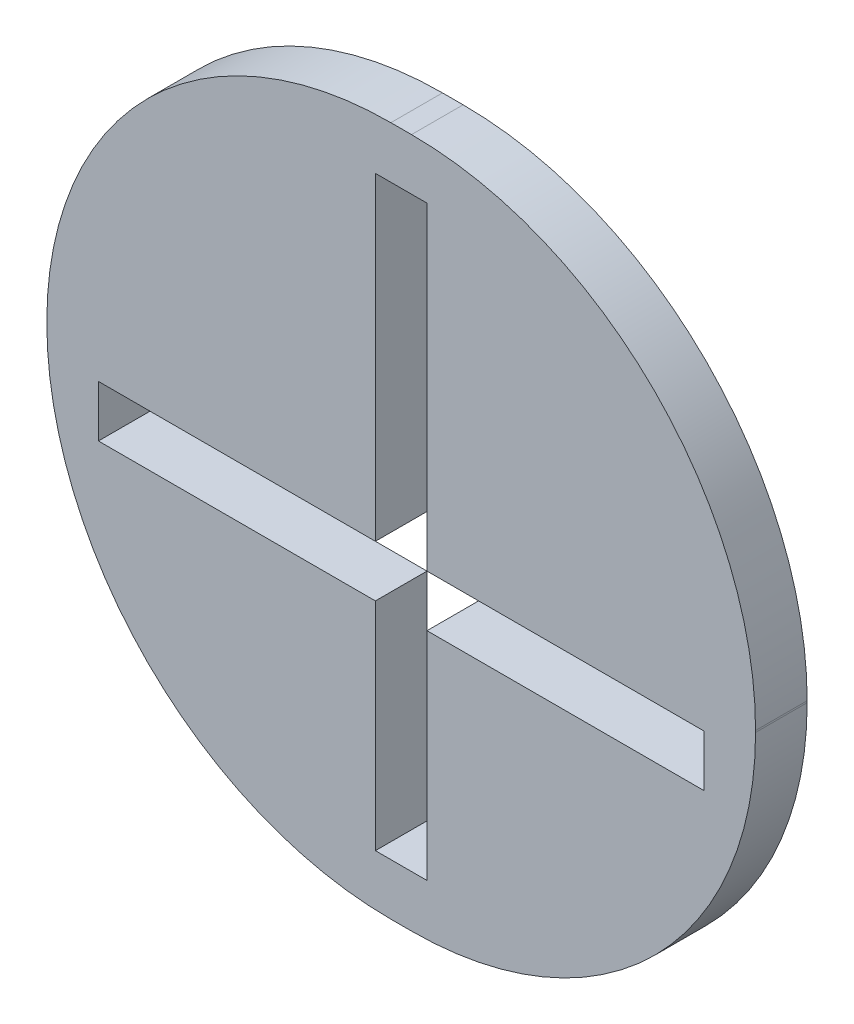
from build123d import *

# Parameters (mm, degrees)
SALIENTE_EXTRUIR1_DEPTH = 3


with BuildPart() as part:
    # Croquis1 → Saliente-Extruir1 (new body)
    with BuildSketch(Plane.XY):
        with BuildLine():
            Line((-0.6, -20.05), (0.6, -20.05))
            ThreePointArc((0.6, -20.05), (14.742135624, -14.192135624), (20.6, -0.05))
            Line((20.6, -0.05), (20.6, 0.05))
            ThreePointArc((20.6, 0.05), (14.742135624, 14.192135624), (0.6, 20.05))
            Line((0.6, 20.05), (-0.6, 20.05))
            ThreePointArc((-0.6, 20.05), (-14.742135624, 14.192135624), (-20.6, 0.05))
            Line((-20.6, 0.05), (-20.6, -0.05))
            ThreePointArc((-20.6, -0.05), (-14.742135624, -14.192135624), (-0.6, -20.05))
        make_face()
        Polygon((-17.6, -4.475), (-17.6, -1.475), (-1.5, -1.475), (-1.5, 17.05), (1.5, 17.05), (1.5, -1.475), (17.6, -1.475), (17.6, -4.475), (1.5, -4.475), (1.5, -17.05), (-1.5, -17.05), (-1.5, -4.475), align=None, mode=Mode.SUBTRACT)
    extrude(amount=SALIENTE_EXTRUIR1_DEPTH)


solid = part.part
